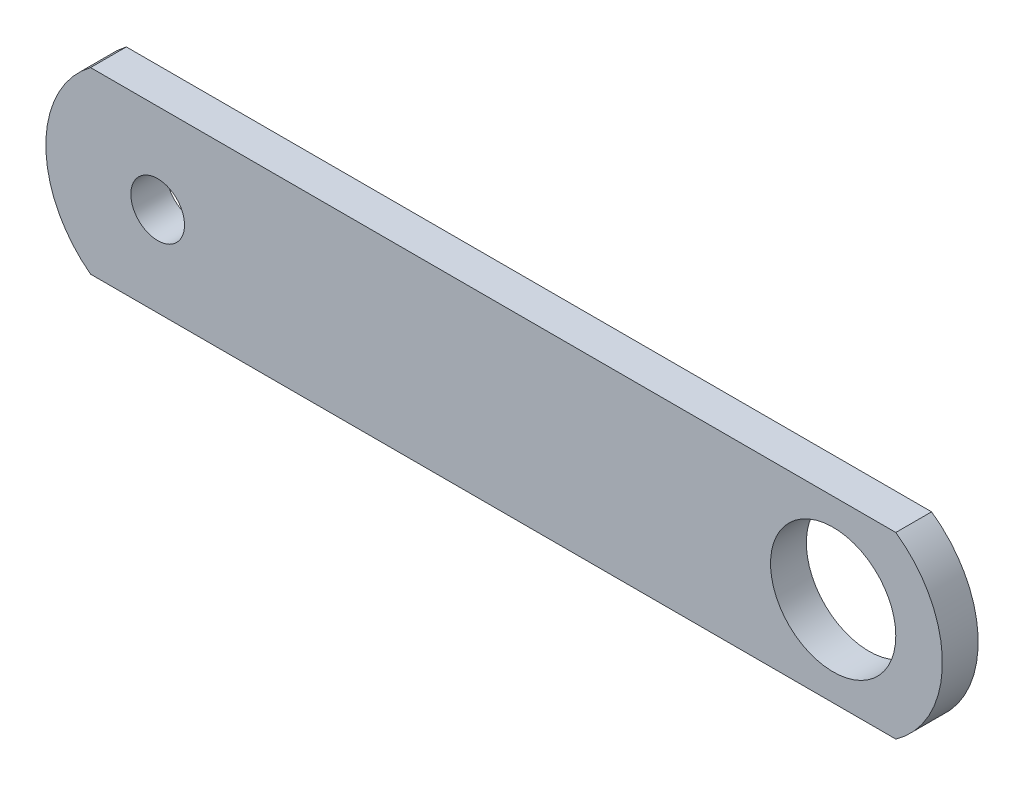
from build123d import *

# Parameters (mm, degrees)
SKETCH2_R           = 3
SKETCH2_R_2         = 7
BOSS_EXTRUDE1_DEPTH = 4


with BuildPart() as part:
    # Sketch2 → Boss-Extrude1 (new body)
    with BuildSketch(Plane.XY):
        with BuildLine():
            Line((-45, -10), (45, -10))
            ThreePointArc((45, -10), (50.206555616, 0), (45, 10))
            Line((45, 10), (-45, 10))
            ThreePointArc((-45, 10), (-50, 0), (-45, -10))
        make_face()
        with Locations((-37.5, 0)):
            Circle(SKETCH2_R, mode=Mode.SUBTRACT)
        with Locations((38, 0)):
            Circle(SKETCH2_R_2, mode=Mode.SUBTRACT)
    extrude(amount=BOSS_EXTRUDE1_DEPTH)


solid = part.part
